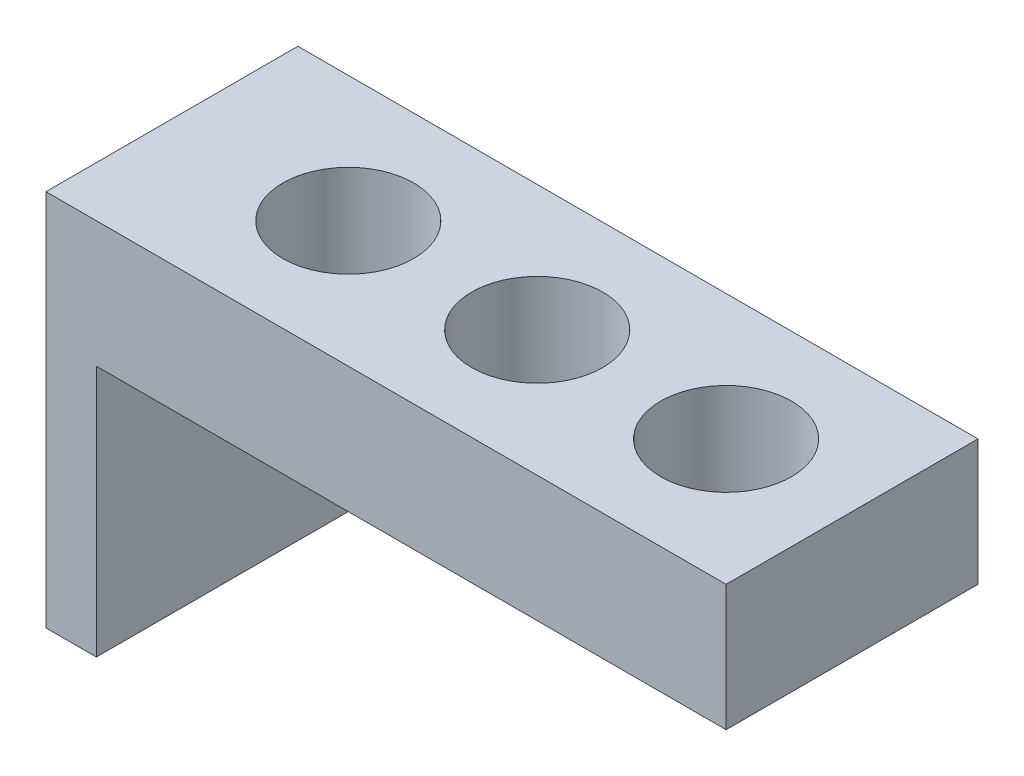
from build123d import *

# Parameters (mm, degrees)
SKETCH1_W           = 25
SKETCH1_H           = 10
SKETCH1_R           = 2.6
BOSS_EXTRUDE1_DEPTH = 5
SKETCH2_W           = 2
SKETCH2_H           = 15
BOSS_EXTRUDE2_DEPTH = 10


with BuildPart() as part:
    # Sketch1 → Boss-Extrude1 (new body)
    with BuildSketch(Plane(origin=(0, 0, 0), x_dir=(1, 0, 0), z_dir=(0, 1, 0))):
        Rectangle(SKETCH1_W, SKETCH1_H)
        with Locations(Location((-7.5, 0, 0), (0, 0, 270))):
            Circle(SKETCH1_R, mode=Mode.SUBTRACT)
        with Locations(Location((0, 0, 0), (0, 0, 270))):
            Circle(SKETCH1_R, mode=Mode.SUBTRACT)
        with Locations(Location((7.5, 0, 0), (0, 0, 270))):
            Circle(SKETCH1_R, mode=Mode.SUBTRACT)
    extrude(amount=BOSS_EXTRUDE1_DEPTH)

    # Sketch2 → Boss-Extrude2 (add)
    with BuildSketch(Plane.XY.offset(5)):
        with Locations((-13.5, -2.5)):
            Rectangle(SKETCH2_W, SKETCH2_H)
    extrude(amount=-BOSS_EXTRUDE2_DEPTH)


solid = part.part
